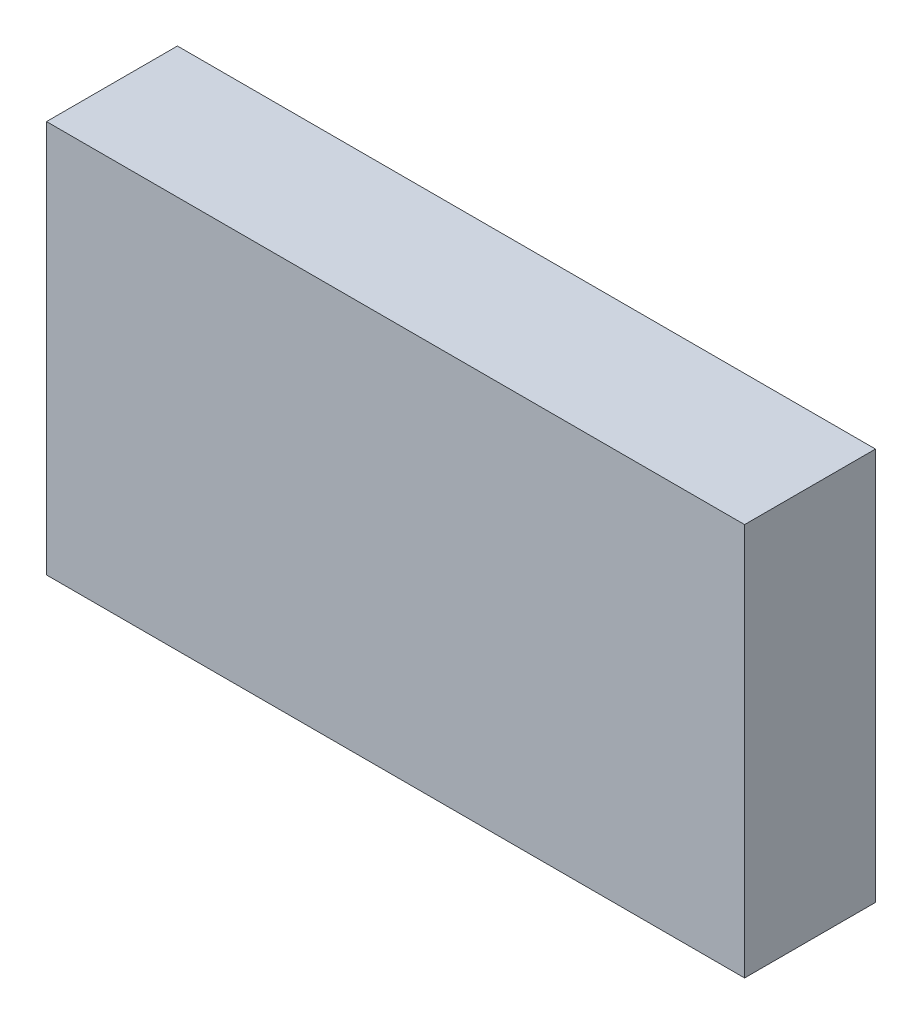
from build123d import *

# Parameters (mm, degrees)
SKETCH_1_W          = 160
SKETCH_1_H          = 90
EXTRUDE_1_DEPTH     = 30
CUT_EXTRUDE_1_DEPTH = 0.5


with BuildPart() as part:
    # 草图1 → 凸台-拉伸1 (new body)
    with BuildSketch(Plane.XY):
        with Locations((-80, 45)):
            Rectangle(SKETCH_1_W, SKETCH_1_H)
    extrude(amount=EXTRUDE_1_DEPTH)

    # 草图3 → 切除-拉伸1 (cut)
    # profile 1 of 9: a face of its own
    with BuildSketch(Plane(origin=(0, 0, 0), x_dir=(-1, 0, 0), z_dir=(0, 0, -1))):
        with BuildLine():
            Line((10.758959915, 77.174447246), (11.445358152, 77.174447246))
            add(Edge.make_bspline(
                [(11.445358152, 77.174447246), (11.492569058, 77.174395349), (11.583027251, 77.174295914), (11.712742307, 77.171281168), (11.830552038, 77.167254476), (11.936202419, 77.161672583), (12.030018517, 77.155075992), (12.111575817, 77.145823953), (12.181515373, 77.136163658), (12.223421822, 77.126342251), (12.242533633, 77.121863111)],
                knots=[0, 0, 0, 0, 1.415646017, 2.712440637, 3.8905458, 4.950247383, 5.884950622, 6.709939814, 7.411656543, 8, 8, 8, 8], degree=3))
            add(Edge.make_bspline(
                [(12.242533633, 77.121863111), (12.266727166, 77.115241161), (12.314544144, 77.102153299), (12.383445187, 77.075939576), (12.448999032, 77.044857411), (12.511430591, 77.009433471), (12.569972674, 76.968147907), (12.625498715, 76.922674289), (12.677518695, 76.87196272), (12.725740087, 76.816581981), (12.770024884, 76.757461771), (12.808154567, 76.693719541), (12.840081794, 76.626428237), (12.867465066, 76.555634666), (12.88717352, 76.480744343), (12.90202042, 76.40227763), (12.911444047, 76.32024294), (12.912346609, 76.264183073), (12.912806069, 76.235645162)],
                knots=[0, 0, 0, 0, 0.999701418, 1.975846123, 2.934577507, 3.890451536, 4.834027766, 5.787354733, 6.749476667, 7.726910423, 8.712836071, 9.690891519, 10.682875813, 11.679750201, 12.712814741, 13.765529915, 14.8625177, 16, 16, 16, 16], degree=3))
            add(Edge.make_bspline(
                [(12.912806069, 76.235645162), (12.912384644, 76.206867385), (12.911560098, 76.150561722), (12.901663813, 76.068188933), (12.888333621, 75.989470543), (12.867836569, 75.914581093), (12.840990895, 75.843965322), (12.809498843, 75.77654409), (12.771515312, 75.713464418), (12.727870483, 75.654497301), (12.679318888, 75.599587388), (12.62606595, 75.549132594), (12.568326658, 75.503428256), (12.506284509, 75.462371912), (12.439334661, 75.426915632), (12.368492507, 75.395158327), (12.293142291, 75.368487267), (12.240999777, 75.354457205), (12.214488761, 75.347323848)],
                knots=[0, 0, 0, 0, 1.121902311, 2.195077645, 3.232258892, 4.234102512, 5.217864754, 6.176164875, 7.132989551, 8.084763148, 9.034132444, 9.988522005, 10.94243251, 11.903244335, 12.886203696, 13.894208494, 14.929344452, 16, 16, 16, 16], degree=3))
            add(Edge.make_bspline(
                [(12.214488761, 75.347323848), (12.192561427, 75.342660867), (12.144506399, 75.332441673), (12.065363677, 75.321033216), (11.973218291, 75.311295615), (11.868196011, 75.303994478), (11.750391107, 75.297744109), (11.619739849, 75.292776015), (11.475985772, 75.290046162), (11.375714528, 75.289905369), (11.32336296, 75.289831861)],
                knots=[0, 0, 0, 0, 0.601384939, 1.31797006, 2.144135048, 3.087295005, 4.142315834, 5.309527816, 6.595305764, 8, 8, 8, 8], degree=3))
            Line((11.32336296, 75.289831861), (11.073062479, 75.289831861))
            Line((11.073062479, 75.289831861), (11.073062479, 73.674447246))
            Line((11.073062479, 73.674447246), (10.758959915, 73.674447246))
            Line((10.758959915, 73.674447246), (10.758959915, 77.174447246))
        make_face()
        with BuildLine():
            Line((11.073062479, 76.815472887), (11.073062479, 75.64880622))
            Line((11.073062479, 75.64880622), (11.685842927, 75.64109388))
            add(Edge.make_bspline(
                [(11.685842927, 75.64109388), (11.715762853, 75.641078417), (11.773522653, 75.641048564), (11.856958876, 75.645033788), (11.934368164, 75.649634321), (12.005512739, 75.656370244), (12.070424674, 75.665891502), (12.129212203, 75.675503239), (12.181419485, 75.689408602), (12.242518687, 75.708131671), (12.310602035, 75.740064287), (12.384669583, 75.786414177), (12.44744017, 75.845494885), (12.501758466, 75.911922716), (12.544864344, 75.985821846), (12.576420337, 76.064890783), (12.594961494, 76.148318632), (12.597447688, 76.205406771), (12.598703504, 76.234242919)],
                knots=[0, 0, 0, 0, 1.160613943, 2.240541288, 3.23993089, 4.169200891, 5.011653406, 5.7853311, 6.478053781, 7.106038997, 8.262395093, 9.384106736, 10.481365981, 11.59014053, 12.70357646, 13.786202915, 14.881775077, 16, 16, 16, 16], degree=3))
            add(Edge.make_bspline(
                [(12.598703504, 76.234242919), (12.597440858, 76.262381432), (12.594930873, 76.318317314), (12.57627501, 76.400296075), (12.544925696, 76.478531779), (12.501469101, 76.551504865), (12.448727971, 76.617693669), (12.387428628, 76.675190796), (12.317715367, 76.721412498), (12.252867136, 76.75124578), (12.19526595, 76.769461055), (12.14523399, 76.782205896), (12.088743316, 76.792381502), (12.025775536, 76.800621005), (11.956818702, 76.807674466), (11.881280387, 76.812460443), (11.799446744, 76.8152619), (11.742636173, 76.815400855), (11.713186677, 76.815472887)],
                knots=[0, 0, 0, 0, 1.120700087, 2.227813068, 3.331159281, 4.466773991, 5.599788987, 6.693661531, 7.80175334, 8.91857717, 9.525282508, 10.207424825, 10.974604443, 11.810962634, 12.737642355, 13.736264703, 14.826523623, 16, 16, 16, 16], degree=3))
            Line((11.713186677, 76.815472887), (11.073062479, 76.815472887))
        make_face(mode=Mode.SUBTRACT)
    # profile 2 of 9: a face of its own
    with BuildSketch(Plane(origin=(0, 0, 0), x_dir=(-1, 0, 0), z_dir=(0, 0, -1))):
        with BuildLine():
            add(Edge.make_bspline(
                [(15.268575299, 77.264190835), (15.333383405, 77.262549356), (15.460671872, 77.259325355), (15.64774677, 77.234646251), (15.826341865, 77.191950862), (15.997912004, 77.135087879), (16.160404981, 77.059233494), (16.315043873, 76.967548345), (16.461460747, 76.859071887), (16.597682128, 76.73464266), (16.722339079, 76.599259206), (16.832164965, 76.454781296), (16.924207259, 76.302082493), (16.999793046, 76.141621663), (17.059091656, 75.973761695), (17.100010699, 75.797607692), (17.126148849, 75.614301002), (17.129204627, 75.489274137), (17.130754786, 75.425849489)],
                knots=[0, 0, 0, 0, 1.065120563, 2.091984664, 3.0946048, 4.079830382, 5.057816894, 6.036188127, 7.030412546, 8.04752943, 9.064399622, 10.05169764, 11.02544977, 11.989514704, 12.962713494, 13.945757189, 14.957906945, 16, 16, 16, 16], degree=3))
            add(Edge.make_bspline(
                [(17.130754786, 75.425849489), (17.129204854, 75.362892043), (17.126149757, 75.238795622), (17.09998098, 75.056652178), (17.05893998, 74.881561482), (17.000343714, 74.713815829), (16.925118235, 74.553238265), (16.832463064, 74.400251311), (16.723321853, 74.254804813), (16.599115002, 74.118492148), (16.46371396, 73.993494677), (16.318483693, 73.884575801), (16.166690374, 73.790851677), (16.006380665, 73.716068003), (15.839680629, 73.656296082), (15.665098305, 73.615543452), (15.483451751, 73.589256409), (15.359580748, 73.586237893), (15.296620171, 73.584703656)],
                knots=[0, 0, 0, 0, 1.043624062, 2.057103931, 3.04512605, 4.022047818, 4.998200453, 5.980619268, 6.982898556, 8.009068085, 9.034988726, 10.034168286, 11.015286542, 11.987931943, 12.962482838, 13.94673481, 14.956375938, 16, 16, 16, 16], degree=3))
            add(Edge.make_bspline(
                [(15.296620171, 73.584703656), (15.233195852, 73.586253043), (15.108169636, 73.589307297), (14.924632601, 73.615488701), (14.748354857, 73.656430005), (14.579840506, 73.714939441), (14.418995576, 73.790556672), (14.265505493, 73.882761051), (14.119986346, 73.992168192), (13.9836446, 74.116334767), (13.858895402, 74.251506319), (13.750136026, 74.396340574), (13.657910913, 74.547996031), (13.58254758, 74.706893555), (13.522883121, 74.872264998), (13.482178303, 75.045213475), (13.45584235, 75.224752981), (13.452807504, 75.346995879), (13.451267607, 75.409022566)],
                knots=[0, 0, 0, 0, 1.053102029, 2.075944431, 3.073151272, 4.055350789, 5.033113405, 6.020478099, 7.024410459, 8.052272461, 9.079885166, 10.07527673, 11.055994387, 12.023226415, 12.992069828, 13.970394897, 14.97016774, 16, 16, 16, 16], degree=3))
            add(Edge.make_bspline(
                [(13.451267607, 75.409022566), (13.451802242, 75.450655235), (13.452864769, 75.533395359), (13.465656461, 75.656261959), (13.484218163, 75.777152617), (13.510820075, 75.895723565), (13.545611742, 76.011684549), (13.586663769, 76.125835312), (13.636803615, 76.237019036), (13.693484263, 76.345762428), (13.756746071, 76.450370333), (13.82662182, 76.549249917), (13.900657189, 76.643230913), (13.981820582, 76.729877917), (14.067437028, 76.811711574), (14.158895406, 76.887474291), (14.25563765, 76.957849242), (14.35808003, 77.021269583), (14.463698305, 77.078628717), (14.572575083, 77.127850568), (14.683231654, 77.17009663), (14.796186302, 77.204337455), (14.911139074, 77.231369491), (15.028340859, 77.249776845), (15.147698285, 77.262601163), (15.228109604, 77.263658665), (15.268575299, 77.264190835)],
                knots=[0, 0, 0, 0, 1.037015668, 2.060948919, 3.074880161, 4.083647147, 5.086022904, 6.090072063, 7.104153813, 8.122640571, 9.144368836, 10.147691507, 11.138137339, 12.123020368, 13.103399296, 14.087645067, 15.080126199, 16.082011238, 17.087798457, 18.072939717, 19.057185487, 20.037253025, 21.01195951, 21.997135196, 22.992090687, 24, 24, 24, 24], degree=3))
        make_face()
        with BuildLine():
            add(Edge.make_bspline(
                [(15.283999979, 76.905216476), (15.250785345, 76.904811586), (15.184673612, 76.904005676), (15.086389076, 76.893389961), (14.989397142, 76.878260072), (14.89367778, 76.856678551), (14.799631491, 76.827274498), (14.706381649, 76.79343359), (14.614778596, 76.7522125), (14.525124738, 76.705639795), (14.438209663, 76.654090874), (14.356196961, 76.597119107), (14.278874317, 76.536060553), (14.206431051, 76.470772716), (14.139079878, 76.400923114), (14.075495177, 76.327570678), (14.018225595, 76.248618787), (13.965740018, 76.16620838), (13.918772178, 76.080446799), (13.877006823, 75.992236936), (13.842842815, 75.90085925), (13.814980438, 75.807305092), (13.791880628, 75.711722632), (13.777246703, 75.613386784), (13.766514344, 75.512791672), (13.765754499, 75.444809817), (13.765370171, 75.41042481)],
                knots=[0, 0, 0, 0, 1.008559885, 2.007477868, 2.99961109, 3.989939068, 4.984837346, 5.991145699, 7.001802488, 8.033829008, 9.059044045, 10.069351652, 11.065060232, 12.050310815, 13.029377138, 14.011219647, 14.996725999, 15.989392538, 16.977580475, 17.965360261, 18.951710183, 19.937753436, 20.929683414, 21.935841486, 22.955955122, 24, 24, 24, 24], degree=3))
            add(Edge.make_bspline(
                [(13.765370171, 75.41042481), (13.766645033, 75.359862589), (13.769153081, 75.260391059), (13.791110651, 75.114622915), (13.824932625, 74.974534628), (13.874789992, 74.840892719), (13.937140607, 74.712548436), (14.014167497, 74.590640332), (14.105426582, 74.475135457), (14.209090109, 74.366840188), (14.322412816, 74.267994384), (14.442745546, 74.181230975), (14.568799153, 74.107820726), (14.700902356, 74.048015653), (14.838349895, 74.000625915), (14.982027446, 73.968147284), (15.130977905, 73.946771829), (15.232508561, 73.944719073), (15.283999979, 73.943678015)],
                knots=[0, 0, 0, 0, 1.032063989, 2.030389145, 3.003944642, 3.970395727, 4.937377036, 5.913328081, 6.909231446, 7.93887556, 8.970685674, 9.976071282, 10.964166581, 11.944589148, 12.933237628, 13.927779006, 14.949070134, 16, 16, 16, 16], degree=3))
            add(Edge.make_bspline(
                [(15.283999979, 73.943678015), (15.31860948, 73.944153519), (15.387250517, 73.945096587), (15.489346039, 73.954595264), (15.589602251, 73.969827133), (15.687878531, 73.991757789), (15.784063342, 74.019204995), (15.878558145, 74.051812723), (15.970356436, 74.092493927), (16.060616273, 74.137441879), (16.147012515, 74.188682036), (16.229488047, 74.243720186), (16.305964027, 74.304688807), (16.378353099, 74.369006619), (16.445980788, 74.437970467), (16.508389772, 74.511490689), (16.565369904, 74.590031346), (16.617835551, 74.672316752), (16.664638813, 74.758313004), (16.705417912, 74.846842682), (16.740014028, 74.937687792), (16.767942533, 75.030979363), (16.789827995, 75.126540212), (16.804907915, 75.22449829), (16.815456353, 75.324657633), (16.81625143, 75.392401489), (16.816652222, 75.426550611)],
                knots=[0, 0, 0, 0, 1.047197238, 2.076906641, 3.100256066, 4.114471768, 5.12198147, 6.126382909, 7.136867548, 8.15857795, 9.17633901, 10.174870724, 11.156907918, 12.133735059, 13.104061851, 14.077631395, 15.04955518, 16.038496417, 17.029181396, 18.010275684, 18.986308667, 19.968651475, 20.955262928, 21.950658345, 22.966943676, 24, 24, 24, 24], degree=3))
            add(Edge.make_bspline(
                [(16.816652222, 75.426550611), (16.816251109, 75.460466115), (16.815455428, 75.527743765), (16.804912953, 75.627204584), (16.789812063, 75.724457795), (16.768049355, 75.819121598), (16.739999201, 75.911220123), (16.705411871, 76.000666871), (16.664626571, 76.087795066), (16.617818347, 76.172389363), (16.565202523, 76.253564101), (16.50770828, 76.331166514), (16.444342932, 76.403739255), (16.376916907, 76.473073949), (16.303746022, 76.537691839), (16.225161728, 76.597614359), (16.14211805, 76.654287634), (16.054190814, 76.705413195), (15.963446861, 76.752627428), (15.870332903, 76.793078431), (15.775903803, 76.827450551), (15.680399691, 76.856767516), (15.583016712, 76.878175546), (15.484412884, 76.893403596), (15.384724625, 76.904001982), (15.317681405, 76.90481036), (15.283999979, 76.905216476)],
                knots=[0, 0, 0, 0, 1.02996197, 2.043119294, 3.035359645, 4.018872909, 4.991431989, 5.957985074, 6.929999688, 7.912076566, 8.892894881, 9.867085534, 10.843653904, 11.817741046, 12.803660682, 13.806313499, 14.818574707, 15.856120519, 16.894564902, 17.924820532, 18.937903209, 19.946497019, 20.957711757, 21.963978472, 22.977135795, 24, 24, 24, 24], degree=3))
        make_face(mode=Mode.SUBTRACT)
    # profile 3 of 9: a face of its own
    with BuildSketch(Plane(origin=(0, 0, 0), x_dir=(-1, 0, 0), z_dir=(0, 0, -1))):
        Polygon((17.62434453, 77.174447246), (17.948963921, 77.174447246), (18.633959915, 74.607640355), (19.652689883, 77.174447246), (19.698262799, 77.174447246), (20.698062479, 74.625168399), (21.386564081, 77.174447246), (21.707677863, 77.174447246), (20.763967927, 73.674447246), (20.719096133, 73.674447246), (19.666011197, 76.351330258), (18.600306069, 73.674447246), (18.555434274, 73.674447246), align=None)
    # profile 4 of 9: a face of its own
    with BuildSketch(Plane(origin=(0, 0, 0), x_dir=(-1, 0, 0), z_dir=(0, 0, -1))):
        Polygon((22.335882992, 77.174447246), (24.310241966, 77.174447246), (24.310241966, 76.815472887), (22.649985556, 76.815472887), (22.649985556, 75.73854981), (24.310241966, 75.73854981), (24.310241966, 75.379575451), (22.649985556, 75.379575451), (22.649985556, 74.033421605), (24.310241966, 74.033421605), (24.310241966, 73.674447246), (22.335882992, 73.674447246), align=None)
    # profile 5 of 9: a face of its own
    with BuildSketch(Plane(origin=(0, 0, 0), x_dir=(-1, 0, 0), z_dir=(0, 0, -1))):
        with BuildLine():
            Line((24.938447094, 77.174447246), (25.638867767, 77.174447246))
            add(Edge.make_bspline(
                [(25.638867767, 77.174447246), (25.685608896, 77.17429166), (25.77535704, 77.173992917), (25.903930311, 77.172327154), (26.020757408, 77.167552799), (26.125777247, 77.163444215), (26.218987902, 77.155952274), (26.300675193, 77.148791627), (26.37046289, 77.139417966), (26.412708741, 77.130712543), (26.431836517, 77.126770964)],
                knots=[0, 0, 0, 0, 1.410062039, 2.707475311, 3.878576406, 4.937260626, 5.877586885, 6.699081471, 7.410979367, 8, 8, 8, 8], degree=3))
            add(Edge.make_bspline(
                [(26.431836517, 77.126770964), (26.457443141, 77.120444198), (26.508110131, 77.107925635), (26.581060197, 77.081466034), (26.650574521, 77.050846409), (26.716364345, 77.014882689), (26.778100136, 76.973307909), (26.836418447, 76.926839787), (26.891583911, 76.875732581), (26.941365541, 76.818697739), (26.988304592, 76.75886123), (27.027893219, 76.694157473), (27.062019699, 76.626495945), (27.089190216, 76.555188528), (27.111068189, 76.480926756), (27.126494428, 76.403037959), (27.135745616, 76.321876984), (27.136687472, 76.266519075), (27.137165043, 76.238449649)],
                knots=[0, 0, 0, 0, 1.027469482, 2.033020251, 3.019912614, 3.986113645, 4.951240523, 5.91722682, 6.890402269, 7.87763091, 8.8651537, 9.85103654, 10.82876324, 11.815024772, 12.821070561, 13.842952187, 14.906261191, 16, 16, 16, 16], degree=3))
            add(Edge.make_bspline(
                [(27.137165043, 76.238449649), (27.135696045, 76.191814545), (27.132829649, 76.100817377), (27.106104545, 75.968756496), (27.062328026, 75.845567181), (27.002004737, 75.731404543), (26.925185261, 75.628493898), (26.83286047, 75.538103442), (26.724978858, 75.46246353), (26.624549542, 75.410010725), (26.535835343, 75.376417816), (26.46280203, 75.352781458), (26.383135052, 75.334519492), (26.297597718, 75.31815936), (26.205834062, 75.305807666), (26.108064023, 75.296761072), (26.004217871, 75.291107023), (25.932878802, 75.290265018), (25.896179466, 75.289831861)],
                knots=[0, 0, 0, 0, 1.260483769, 2.459530307, 3.627416485, 4.787058657, 5.939039949, 7.08810263, 8.267026773, 9.491475466, 10.141966685, 10.831826277, 11.566392101, 12.351337768, 13.187381173, 14.07005841, 15.007169909, 16, 16, 16, 16], degree=3))
            Line((25.896179466, 75.289831861), (27.182036838, 73.674447246))
            Line((27.182036838, 73.674447246), (26.793615363, 73.674447246))
            Line((26.793615363, 73.674447246), (25.507757992, 75.289831861))
            Line((25.507757992, 75.289831861), (25.252549658, 75.289831861))
            Line((25.252549658, 75.289831861), (25.252549658, 73.674447246))
            Line((25.252549658, 73.674447246), (24.938447094, 73.674447246))
            Line((24.938447094, 73.674447246), (24.938447094, 77.174447246))
        make_face()
        with BuildLine():
            Line((25.252549658, 76.815472887), (25.252549658, 75.64880622))
            Line((25.252549658, 75.64880622), (25.893374979, 75.643898367))
            add(Edge.make_bspline(
                [(25.893374979, 75.643898367), (25.923295018, 75.643885131), (25.981288575, 75.643859474), (26.06518924, 75.647853251), (26.143309351, 75.652396569), (26.215350103, 75.659345914), (26.281343679, 75.668301986), (26.341257092, 75.67950497), (26.395188144, 75.692557033), (26.458086682, 75.712758659), (26.528323214, 75.744764677), (26.604654674, 75.791330176), (26.669657011, 75.849899295), (26.724574874, 75.916872751), (26.768704305, 75.990509), (26.799816359, 76.069925369), (26.819558802, 76.153116967), (26.821887347, 76.210295075), (26.823062479, 76.239150771)],
                knots=[0, 0, 0, 0, 1.146690395, 2.22261258, 3.21895312, 4.145990853, 4.996080663, 5.770904154, 6.481378293, 7.121626537, 8.300444488, 9.431385265, 10.535395872, 11.636531494, 12.74115979, 13.810798291, 14.895190096, 16, 16, 16, 16], degree=3))
            add(Edge.make_bspline(
                [(26.823062479, 76.239150771), (26.821860358, 76.267297345), (26.819478192, 76.323073584), (26.800029424, 76.404729494), (26.767140042, 76.481796444), (26.722817805, 76.553960929), (26.66881865, 76.619466665), (26.605500837, 76.675513818), (26.534595642, 76.721763283), (26.468324443, 76.751317663), (26.409090231, 76.769437516), (26.357660571, 76.78218868), (26.299549093, 76.792433149), (26.234473635, 76.80064121), (26.162712004, 76.807696154), (26.083901353, 76.812447933), (25.998564572, 76.815261797), (25.939417641, 76.815400886), (25.908799658, 76.815472887)],
                knots=[0, 0, 0, 0, 1.101028733, 2.181837193, 3.264309656, 4.369019818, 5.486613113, 6.575447106, 7.666700264, 8.788928104, 9.402425223, 10.0903467, 10.862060571, 11.710948788, 12.657782767, 13.684531032, 14.801375019, 16, 16, 16, 16], degree=3))
            Line((25.908799658, 76.815472887), (25.252549658, 76.815472887))
        make_face(mode=Mode.SUBTRACT)
    # profile 6 of 9: a face of its own
    with BuildSketch(Plane(origin=(0, 0, 0), x_dir=(-1, 0, 0), z_dir=(0, 0, -1))):
        with BuildLine():
            Line((29.246139402, 77.174447246), (29.92903203, 77.174447246))
            add(Edge.make_bspline(
                [(29.92903203, 77.174447246), (29.962460508, 77.174271495), (30.027253219, 77.173930847), (30.12147266, 77.168647716), (30.209721471, 77.161444046), (30.292025243, 77.150013954), (30.368345946, 77.136222176), (30.438913583, 77.11952036), (30.503503755, 77.099493747), (30.580616492, 77.067647465), (30.668537153, 77.020324297), (30.763735545, 76.950395732), (30.845139785, 76.864863269), (30.915326102, 76.768380613), (30.971127221, 76.662244842), (31.011496519, 76.548985653), (31.037054394, 76.430063911), (31.039682828, 76.348420733), (31.041011197, 76.307159585)],
                knots=[0, 0, 0, 0, 1.001505555, 1.941167018, 2.826882275, 3.653841531, 4.429895133, 5.150066043, 5.825578002, 6.45369114, 7.647487171, 8.808567382, 9.977351308, 11.170798116, 12.373658725, 13.556498008, 14.765093433, 16, 16, 16, 16], degree=3))
            add(Edge.make_bspline(
                [(31.041011197, 76.307159585), (31.039917978, 76.26850703), (31.037769701, 76.192551113), (31.017226942, 76.081457003), (30.985066273, 75.975705785), (30.940361024, 75.875683399), (30.882259028, 75.783649786), (30.813400709, 75.69886252), (30.730323907, 75.624911463), (30.668080667, 75.58356856), (30.636463921, 75.562568239)],
                knots=[0, 0, 0, 0, 1.044552857, 2.05264487, 3.044412934, 4.028983338, 5.005914585, 5.980388656, 6.974128949, 8, 8, 8, 8], degree=3))
            add(Edge.make_bspline(
                [(30.636463921, 75.562568239), (30.676224349, 75.54730324), (30.752295896, 75.518097516), (30.856981908, 75.466462052), (30.947176753, 75.410299941), (31.023573899, 75.348968091), (31.088911554, 75.282859281), (31.145964496, 75.211004166), (31.19464587, 75.132465408), (31.236358794, 75.048061873), (31.26890755, 74.958655405), (31.293283454, 74.865084629), (31.307250903, 74.767685073), (31.309238544, 74.701399694), (31.310241966, 74.667936829)],
                knots=[0, 0, 0, 0, 1.27268992, 2.434971085, 3.483601985, 4.442670788, 5.356604649, 6.2567628, 7.179492994, 8.113709626, 9.066344395, 10.018646069, 10.999752585, 12, 12, 12, 12], degree=3))
            add(Edge.make_bspline(
                [(31.310241966, 74.667936829), (31.30926512, 74.633769957), (31.307343148, 74.566545679), (31.293163176, 74.467790544), (31.269154069, 74.373415598), (31.236082923, 74.282810415), (31.192920608, 74.19615028), (31.140392644, 74.113337016), (31.07776108, 74.035202686), (31.007698211, 73.960879063), (30.928436066, 73.894051275), (30.842920311, 73.834535569), (30.750073991, 73.785589507), (30.651421997, 73.744473485), (30.545857681, 73.713066287), (30.433855074, 73.691093713), (30.315510772, 73.676288676), (30.234301021, 73.675071471), (30.192653825, 73.674447246)],
                knots=[0, 0, 0, 0, 0.978564426, 1.925352924, 2.850884081, 3.763762016, 4.682927383, 5.618979971, 6.567305752, 7.547517671, 8.540179244, 9.531824382, 10.526200242, 11.540722885, 12.589160233, 13.674978461, 14.80764778, 16, 16, 16, 16], degree=3))
            Line((30.192653825, 73.674447246), (29.246139402, 73.674447246))
            Line((29.246139402, 73.674447246), (29.246139402, 77.174447246))
        make_face()
        with BuildLine():
            Line((29.560241966, 76.815472887), (29.560241966, 75.693678015))
            Line((29.560241966, 75.693678015), (29.771279626, 75.693678015))
            add(Edge.make_bspline(
                [(29.771279626, 75.693678015), (29.802128422, 75.694077938), (29.861734581, 75.694850671), (29.948054477, 75.697064188), (30.028179496, 75.703262231), (30.101971329, 75.709458493), (30.169313773, 75.719533081), (30.230057634, 75.731525204), (30.285156231, 75.744208109), (30.348695777, 75.765777596), (30.420768725, 75.797655271), (30.497601829, 75.847127107), (30.565336299, 75.90605146), (30.622533487, 75.974042422), (30.669344957, 76.048908608), (30.701858672, 76.129455488), (30.723905956, 76.21367562), (30.725897488, 76.271493873), (30.726908633, 76.300849489)],
                knots=[0, 0, 0, 0, 1.156816544, 2.235205308, 3.236616184, 4.169592532, 5.011045266, 5.787822928, 6.49130361, 7.128639758, 8.301311294, 9.436451833, 10.541879658, 11.654887649, 12.756523258, 13.837046038, 14.901820046, 16, 16, 16, 16], degree=3))
            add(Edge.make_bspline(
                [(30.726908633, 76.300849489), (30.726382452, 76.320275261), (30.725350293, 76.358381033), (30.71689699, 76.413930387), (30.702529416, 76.466174139), (30.684075122, 76.51582825), (30.658286434, 76.5613401), (30.62792297, 76.604283296), (30.59123728, 76.643195414), (30.549479967, 76.679564913), (30.501471344, 76.71180944), (30.447240053, 76.740050203), (30.386052376, 76.76279098), (30.318939521, 76.782707133), (30.244868433, 76.796695426), (30.16469388, 76.808348814), (30.077759161, 76.814281556), (30.017614058, 76.815066919), (29.986524017, 76.815472887)],
                knots=[0, 0, 0, 0, 0.91205012, 1.789085906, 2.630437955, 3.453916878, 4.269457761, 5.079663411, 5.91843418, 6.774407191, 7.675494373, 8.627863946, 9.638891023, 10.736472738, 11.911756761, 13.175263542, 14.539845004, 16, 16, 16, 16], degree=3))
            Line((29.986524017, 76.815472887), (29.560241966, 76.815472887))
        make_face(mode=Mode.SUBTRACT)
        with BuildLine():
            Line((29.560241966, 75.334703656), (29.560241966, 74.033421605))
            Line((29.560241966, 74.033421605), (30.007557671, 74.033421605))
            add(Edge.make_bspline(
                [(30.007557671, 74.033421605), (30.039576597, 74.033805352), (30.101288856, 74.034544974), (30.190390086, 74.036959529), (30.272973189, 74.042451805), (30.348661325, 74.051097654), (30.418271778, 74.060476104), (30.480969481, 74.073087384), (30.537262674, 74.087536345), (30.602536982, 74.109870517), (30.67604049, 74.144566988), (30.755251347, 74.196881215), (30.825677565, 74.259204522), (30.885482824, 74.331335437), (30.934495813, 74.409766763), (30.970151268, 74.492912113), (30.992142124, 74.579397641), (30.994804294, 74.638364353), (30.996139402, 74.667936829)],
                knots=[0, 0, 0, 0, 1.160039823, 2.235823828, 3.228722157, 4.157150951, 4.99529583, 5.772374946, 6.472645482, 7.099169577, 8.269452708, 9.405989375, 10.527446681, 11.663510218, 12.788923519, 13.866172445, 14.929861265, 16, 16, 16, 16], degree=3))
            add(Edge.make_bspline(
                [(30.996139402, 74.667936829), (30.995863298, 74.686430169), (30.995315542, 74.723118551), (30.987054928, 74.77703437), (30.975041058, 74.829260244), (30.959509624, 74.879937984), (30.936890157, 74.928151361), (30.910483612, 74.97485392), (30.87952221, 75.0201074), (30.831278044, 75.077319653), (30.76110606, 75.143236666), (30.661399284, 75.207774168), (30.548026986, 75.259821975), (30.465799493, 75.281921452), (30.423322895, 75.29333747)],
                knots=[0, 0, 0, 0, 0.723448775, 1.435228256, 2.130040452, 2.821711965, 3.505591119, 4.210454504, 4.921174351, 5.648778258, 7.137944449, 8.670945889, 10.280296675, 12, 12, 12, 12], degree=3))
            add(Edge.make_bspline(
                [(30.423322895, 75.29333747), (30.4062938, 75.296792554), (30.369371207, 75.304283889), (30.309163627, 75.312191592), (30.240427758, 75.319236652), (30.163004881, 75.32444781), (30.07679704, 75.329834353), (29.981620121, 75.331929174), (29.877862806, 75.334428434), (29.805870434, 75.334609569), (29.768475139, 75.334703656)],
                knots=[0, 0, 0, 0, 0.634451884, 1.375622551, 2.216452059, 3.157844607, 4.20941857, 5.370758133, 6.634282058, 8, 8, 8, 8], degree=3))
            Line((29.768475139, 75.334703656), (29.560241966, 75.334703656))
        make_face(mode=Mode.SUBTRACT)
    # profile 7 of 9: a face of its own
    with BuildSketch(Plane(origin=(0, 0, 0), x_dir=(-1, 0, 0), z_dir=(0, 0, -1))):
        Polygon((33.46408812, 77.174447246), (35.079472735, 73.674447246), (34.738026421, 73.674447246), (34.220598536, 74.796242117), (32.633959915, 74.796242117), (32.101808472, 73.674447246), (31.758959915, 73.674447246), (33.419216325, 77.174447246), align=None)
        Polygon((33.438146613, 76.492255739), (32.804332511, 75.155216476), (34.055133793, 75.155216476), align=None, mode=Mode.SUBTRACT)
    # profile 8 of 9: a face of its own
    with BuildSketch(Plane(origin=(0, 0, 0), x_dir=(-1, 0, 0), z_dir=(0, 0, -1))):
        Polygon((35.707677863, 73.674447246), (35.707677863, 77.174447246), (35.773583312, 77.174447246), (38.085882992, 74.419739714), (38.085882992, 77.174447246), (38.399985556, 77.174447246), (38.399985556, 73.674447246), (38.328471133, 73.674447246), (36.021780427, 76.422844681), (36.021780427, 73.674447246), align=None)
    # profile 9 of 9: a face of its own
    with BuildSketch(Plane(origin=(0, 0, 0), x_dir=(-1, 0, 0), z_dir=(0, 0, -1))):
        Polygon((39.297421453, 77.174447246), (39.611524017, 77.174447246), (39.611524017, 75.841614714), (41.070558472, 77.174447246), (41.518575299, 77.174447246), (39.798723536, 75.603934425), (41.653190684, 73.674447246), (41.234620972, 73.674447246), (39.611524017, 75.363449649), (39.611524017, 73.674447246), (39.297421453, 73.674447246), align=None)
    extrude(amount=-CUT_EXTRUDE_1_DEPTH, mode=Mode.SUBTRACT)


solid = part.part
